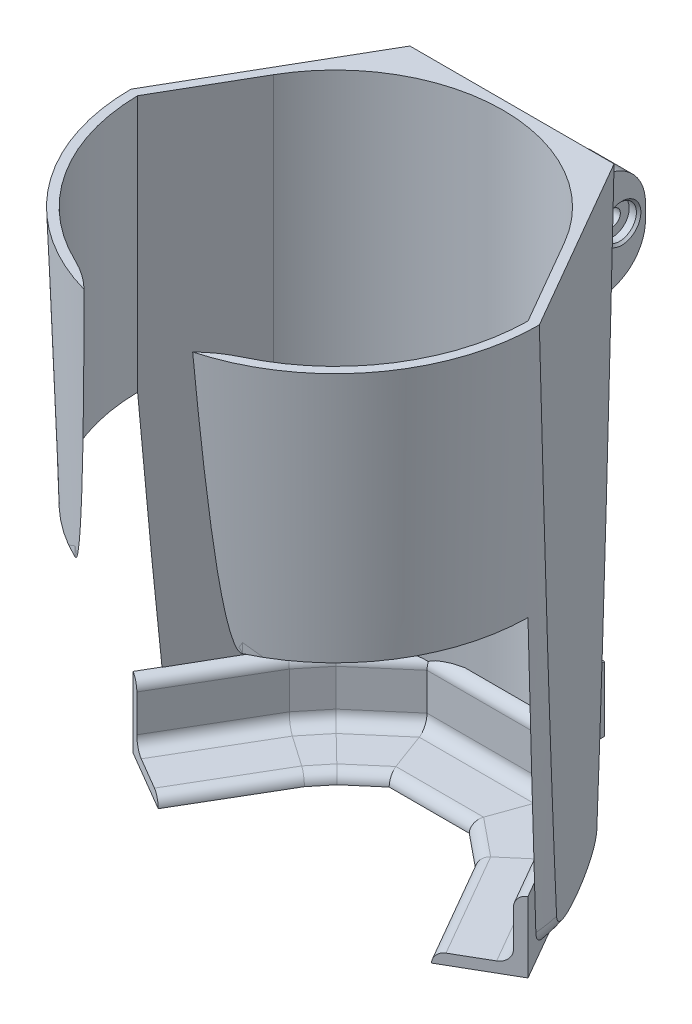
from build123d import *

# Parameters (mm, degrees)
SKETCH1_OUTSIDE_W                = 163.666
SKETCH1_OUTSIDE_H                = 163.666
CUT_EXTRUDE2_DEPTH               = 165.1
BOSS_EXTRUDE1_DEPTH              = 149.606
CUT_EXTRUDE9_DEPTH               = 182.207848358
CUT_EXTRUDE9_DEPTH_BACK          = 208.788
CUT_EXTRUDE10_DEPTH              = 208.788
ANGLE_IRON_20_X_20_X_3_1_DEPTH   = 43.889018667
ANGLE_IRON_20_X_20_X_3_1_2_DEPTH = 40.280709109
ANGLE_IRON_20_X_20_X_3_1_3_DEPTH = 59.714883525
ANGLE_IRON_20_X_20_X_3_1_4_DEPTH = 34.672034404
ANGLE_IRON_20_X_20_X_3_1_5_DEPTH = 16.604491279
ANGLE_IRON_20_X_20_X_3_1_6_DEPTH = 34.959676577
SKETCH117_W                      = 11.584586995
SKETCH117_H                      = 29.5192439
BOSS_EXTRUDE3_DEPTH              = 13.208
SKETCH117_W_2                    = 7.994333108
SKETCH117_H_2                    = 18.359518205
BOSS_EXTRUDE3_2_DEPTH            = 13.208
FILLET6_R                        = 12.7


with BuildPart() as part:
    # Sketch2 → Revolve11 (revolve)
    with BuildSketch(Plane.XY, mode=Mode.PRIVATE) as revolve11_sk:
        with BuildLine():
            Line((-57.831812056, 0), (-52.447796873, -154.178022466))
            ThreePointArc((-52.447796873, -154.178022466), (-50.072368251, -159.513322505), (-44.65741707, -161.701104794))
            Line((-44.65741707, -161.701104794), (0, -161.701104794))
            Line((0, -161.701104794), (0, 0))
            Line((0, 0), (-57.831812056, 0))
        make_face()
    revolve(revolve11_sk.sketch.rotate(Axis((0, -161.701104794, 0), (0, 1, 0)), 180), axis=Axis((0, -161.701104794, 0), (0, 1, 0)))

    # Sketch1 outside → Cut-Extrude2 (cut)
    with BuildSketch(Plane(origin=(0, 0, 0), x_dir=(1, 0, 0), z_dir=(0, 1, 0))):
        Rectangle(SKETCH1_OUTSIDE_W, SKETCH1_OUTSIDE_H)
        with BuildLine():
            Line((57.831812056, 0), (28.915906028, 50.083818387))
            Line((28.915906028, 50.083818387), (-28.915906028, 50.083818387))
            Line((-28.915906028, 50.083818387), (-57.831812056, 0))
            ThreePointArc((-57.831812056, 0), (0, -57.831812056), (57.831812056, 0))
        make_face(mode=Mode.SUBTRACT)
    extrude(amount=-CUT_EXTRUDE2_DEPTH, mode=Mode.SUBTRACT)

    # Sketch1<3> → Boss-Extrude1 (add)
    with BuildSketch(Plane(origin=(0, 0, 0), x_dir=(1, 0, 0), z_dir=(0, 1, 0))):
        with BuildLine():
            ThreePointArc((23.685181667, -49.961952022), (0, -55.291812056), (-23.685181667, -49.961952022))
            ThreePointArc((-23.685181667, -49.961952022), (-19.292461206, -52.510148632), (-15.38099396, -55.748932819))
            ThreePointArc((-15.38099396, -55.748932819), (0, -57.831812056), (15.38099396, -55.748932819))
            ThreePointArc((15.38099396, -55.748932819), (19.292461206, -52.510148632), (23.685181667, -49.961952022))
        make_face()
    extrude(amount=-BOSS_EXTRUDE1_DEPTH)

    # Sketch1<4> → Cut-Extrude9 (cut, two sides: drawn at the far end of the back side and taken through both)
    with BuildSketch(Plane(origin=(0, 0, 0), x_dir=(1, 0, 0), z_dir=(0, 1, 0)).offset(-CUT_EXTRUDE9_DEPTH_BACK)):
        with BuildLine():
            ThreePointArc((55.08705263, -4.754062779), (55.225083453, -2.715628487), (55.287710177, -0.673486287))
            Line((55.287710177, -0.673486287), (-55.287710177, -0.673486287))
            ThreePointArc((-55.287710177, -0.673486287), (-55.225083453, -2.715628487), (-55.08705263, -4.754062779))
            ThreePointArc((-55.08705263, -4.754062779), (-45.411502249, -31.543302679), (-23.685181667, -49.961952022))
            ThreePointArc((-23.685181667, -49.961952022), (-19.292461206, -52.510148632), (-15.38099396, -55.748932819))
            ThreePointArc((-15.38099396, -55.748932819), (0, -57.831812056), (15.38099396, -55.748932819))
            ThreePointArc((15.38099396, -55.748932819), (19.292461206, -52.510148632), (23.685181667, -49.961952022))
            ThreePointArc((23.685181667, -49.961952022), (45.411502249, -31.543302679), (55.08705263, -4.754062779))
        make_face()
    extrude(amount=CUT_EXTRUDE9_DEPTH + CUT_EXTRUDE9_DEPTH_BACK, mode=Mode.SUBTRACT)

    # Sketch1<9> → Cut-Extrude10 (cut)
    with BuildSketch(Plane(origin=(0, 0, 0), x_dir=(1, 0, 0), z_dir=(0, 1, 0))):
        with BuildLine():
            Line((-55.287710177, -0.673486287), (55.287710177, -0.673486287))
            Line((55.287710177, -0.673486287), (41.174154516, 23.771909194))
            ThreePointArc((41.174154516, 23.771909194), (23.771909194, 41.174154516), (0, 47.543818387))
            ThreePointArc((0, 47.543818387), (-23.771909194, 41.174154516), (-41.174154516, 23.771909194))
            Line((-41.174154516, 23.771909194), (-55.287710177, -0.673486287))
        make_face()
    extrude(amount=-CUT_EXTRUDE10_DEPTH, mode=Mode.SUBTRACT)


with BuildPart() as body_2:
    # Sketch113 → Angle iron 20 X 20 X 3(1) (new body)
    with BuildSketch(Plane(origin=(55.287710177, -161.147020116, 0.673486287), x_dir=(-0.8660254037844395, 6.01688096079423e-15, 0.49999999999999856), z_dir=(-0.49999999999999856, 0, -0.8660254037844395))):
        with BuildLine():
            Line((0, 0), (0, 20))
            ThreePointArc((0, 20), (2.121320344, 19.121320344), (3, 17))
            Line((3, 17), (3, 6.5))
            ThreePointArc((3, 6.5), (4.025126266, 4.025126266), (6.5, 3))
            Line((6.5, 3), (17, 3))
            ThreePointArc((17, 3), (19.121320344, 2.121320344), (20, 0))
            Line((20, 0), (0, 0))
        make_face()
    extrude(amount=ANGLE_IRON_20_X_20_X_3_1_DEPTH)

    # Angle iron 20 X 20 X 3(1) mitre 1
    split(bisect_by=Plane(origin=(36.443291604, -161.147020116, -31.966004122), x_dir=(0, 1, 0), z_dir=(0.648355487, 0, 0.761337745)), keep=Keep.TOP)


with BuildPart() as body_3:
    # Sketch113 on segment 2 (carried to segment 2) → Angle iron 20 X 20 X 3_1 2 (new body)
    with BuildSketch(Plane(origin=(41.25051204, -161.147020116, -28.05028164), x_dir=(-0.631549652, 0, 0.775335435), z_dir=(-0.775335435, 0, -0.631549652))):
        with BuildLine():
            Line((0, 0), (0, 20))
            ThreePointArc((0, 20), (2.121320344, 19.121320344), (3, 17))
            Line((3, 17), (3, 6.5))
            ThreePointArc((3, 6.5), (4.025126266, 4.025126266), (6.5, 3))
            Line((6.5, 3), (17, 3))
            ThreePointArc((17, 3), (19.121320344, 2.121320344), (20, 0))
            Line((20, 0), (0, 0))
        make_face()
    extrude(amount=ANGLE_IRON_20_X_20_X_3_1_2_DEPTH)

    # Angle iron 20 X 20 X 3_1 2 mitre 1
    split(bisect_by=Plane(origin=(36.443291604, -161.147020116, -31.966004122), x_dir=(0, -1, 0), z_dir=(-0.648355487, 0, -0.761337745)), keep=Keep.TOP)

    # Angle iron 20 X 20 X 3_1 2 mitre 2
    split(bisect_by=Plane(origin=(18.595991616, -161.147020116, -46.503526318), x_dir=(0, 1, 0), z_dir=(0.942161195, 0, 0.335160085)), keep=Keep.TOP)


with BuildPart() as body_4:
    # Sketch113 on segment 3 (carried to segment 3) → Angle iron 20 X 20 X 3_1 3 (new body)
    with BuildSketch(Plane(origin=(29.657708018, -161.147020116, -46.503526318), x_dir=(0, 0, 1), z_dir=(-1, 0, 0))):
        with BuildLine():
            Line((0, 0), (0, 20))
            ThreePointArc((0, 20), (2.121320344, 19.121320344), (3, 17))
            Line((3, 17), (3, 6.5))
            ThreePointArc((3, 6.5), (4.025126266, 4.025126266), (6.5, 3))
            Line((6.5, 3), (17, 3))
            ThreePointArc((17, 3), (19.121320344, 2.121320344), (20, 0))
            Line((20, 0), (0, 0))
        make_face()
    extrude(amount=ANGLE_IRON_20_X_20_X_3_1_3_DEPTH)

    # Angle iron 20 X 20 X 3_1 3 mitre 1
    split(bisect_by=Plane(origin=(18.595991616, -161.147020116, -46.503526318), x_dir=(0, -1, 0), z_dir=(-0.942161195, 0, -0.335160085)), keep=Keep.TOP)

    # Angle iron 20 X 20 X 3_1 3 mitre 2
    split(bisect_by=Plane(origin=(-18.595991616, -161.147020116, -46.503526318), x_dir=(0, 1, 0), z_dir=(0.937904964, 0, -0.346892314)), keep=Keep.TOP)


with BuildPart() as body_5:
    # Sketch113 on segment 4 (carried to segment 4) → Angle iron 20 X 20 X 3_1 4 (new body)
    with BuildSketch(Plane(origin=(-9.893154293, -161.147020116, -53.961365061), x_dir=(0.650704047, 0, 0.759331445), z_dir=(-0.759331445, 0, 0.650704047))):
        with BuildLine():
            Line((0, 0), (0, 20))
            ThreePointArc((0, 20), (2.121320344, 19.121320344), (3, 17))
            Line((3, 17), (3, 6.5))
            ThreePointArc((3, 6.5), (4.025126266, 4.025126266), (6.5, 3))
            Line((6.5, 3), (17, 3))
            ThreePointArc((17, 3), (19.121320344, 2.121320344), (20, 0))
            Line((20, 0), (0, 0))
        make_face()
    extrude(amount=ANGLE_IRON_20_X_20_X_3_1_4_DEPTH)

    # Angle iron 20 X 20 X 3_1 4 mitre 1
    split(bisect_by=Plane(origin=(-18.595991616, -161.147020116, -46.503526318), x_dir=(0, -1, 0), z_dir=(-0.937904964, 0, 0.346892314)), keep=Keep.TOP)

    # Angle iron 20 X 20 X 3_1 4 mitre 2
    split(bisect_by=Plane(origin=(-33.53690704, -161.147020116, -33.700007909), x_dir=(0, 1, 0), z_dir=(0.698226899, 0, -0.715876524)), keep=Keep.TOP)


with BuildPart() as body_6:
    # Sketch113 on segment 5 (carried to segment 5) → Angle iron 20 X 20 X 3_1 5 (new body)
    with BuildSketch(Plane(origin=(-31.30473119, -161.147020116, -36.440386322), x_dir=(0.775335435, 0, 0.631549652), z_dir=(-0.631549652, 0, 0.775335435))):
        with BuildLine():
            Line((0, 0), (0, 20))
            ThreePointArc((0, 20), (2.121320344, 19.121320344), (3, 17))
            Line((3, 17), (3, 6.5))
            ThreePointArc((3, 6.5), (4.025126266, 4.025126266), (6.5, 3))
            Line((6.5, 3), (17, 3))
            ThreePointArc((17, 3), (19.121320344, 2.121320344), (20, 0))
            Line((20, 0), (0, 0))
        make_face()
    extrude(amount=ANGLE_IRON_20_X_20_X_3_1_5_DEPTH)

    # Angle iron 20 X 20 X 3_1 5 mitre 1
    split(bisect_by=Plane(origin=(-33.53690704, -161.147020116, -33.700007909), x_dir=(0, -1, 0), z_dir=(-0.698226899, 0, 0.715876524)), keep=Keep.TOP)

    # Angle iron 20 X 20 X 3_1 5 mitre 2
    split(bisect_by=Plane(origin=(-39.787465506, -161.147020116, -26.026376149), x_dir=(0, 1, 0), z_dir=(0.570305924, 0, -0.821432379)), keep=Keep.TOP)


with BuildPart() as body_7:
    # Sketch113 on segment 6 (carried to segment 6) → Angle iron 20 X 20 X 3_1 6 (new body)
    with BuildSketch(Plane(origin=(-38.18290835, -161.147020116, -28.763621981), x_dir=(0.862702814, 0, 0.505711236), z_dir=(-0.505711236, 0, 0.862702814))):
        with BuildLine():
            Line((0, 0), (0, 20))
            ThreePointArc((0, 20), (2.121320344, 19.121320344), (3, 17))
            Line((3, 17), (3, 6.5))
            ThreePointArc((3, 6.5), (4.025126266, 4.025126266), (6.5, 3))
            Line((6.5, 3), (17, 3))
            ThreePointArc((17, 3), (19.121320344, 2.121320344), (20, 0))
            Line((20, 0), (0, 0))
        make_face()
    extrude(amount=ANGLE_IRON_20_X_20_X_3_1_6_DEPTH)

    # Angle iron 20 X 20 X 3_1 6 mitre 1
    split(bisect_by=Plane(origin=(-39.787465506, -161.147020116, -26.026376149), x_dir=(0, -1, 0), z_dir=(-0.570305924, 0, 0.821432379)), keep=Keep.TOP)


with BuildPart() as body_8:
    # Sketch117 → Boss-Extrude3 (new body)
    with BuildSketch(Plane(origin=(0, 0, -50.083818387), x_dir=(-1, 0, 0), z_dir=(0, 0, -1))):
        with Locations((-18.818197217, -20.373420654)):
            Rectangle(SKETCH117_W, SKETCH117_H)
    extrude(amount=BOSS_EXTRUDE3_DEPTH)

    # Sketch119 → CBORE for #8 Binding Head Machine Screw1 (revolve, cut)
    with BuildSketch(Plane(origin=(24.610490715, -19.964386098, -56.583251088), x_dir=(0, 0, -1), z_dir=(0, 1, 0))):
        Polygon((0, 0), (0, 91.295626507), (2.2479, 91.295626507), (2.2479, 2.667), (4.7625, 2.667), (4.7625, 0.635), (5.3975, 0), align=None)
    revolve(axis=Axis((30.960490715, -19.964386098, -56.583251088), (-1, 0, 0)), mode=Mode.SUBTRACT)

    # Fillet6
    fillet6_edges = [body_8.edges().sort_by_distance(p)[0] for p in [
        (18.818197217, -5.613798704, -63.291818387),
        (18.818197217, -35.133042604, -63.291818387),
    ]]
    fillet(fillet6_edges, radius=FILLET6_R)


with BuildPart() as body_9:
    # Sketch117 → Boss-Extrude3 2 (new body)
    with BuildSketch(Plane(origin=(0, 0, -50.083818387), x_dir=(-1, 0, 0), z_dir=(0, 0, -1))):
        with Locations((-9.028737166, -145.801655236)):
            Rectangle(SKETCH117_W_2, SKETCH117_H_2)
    extrude(amount=BOSS_EXTRUDE3_2_DEPTH)


solid = Compound([part.part, body_2.part, body_3.part, body_4.part, body_5.part, body_6.part, body_7.part, body_8.part, body_9.part])
